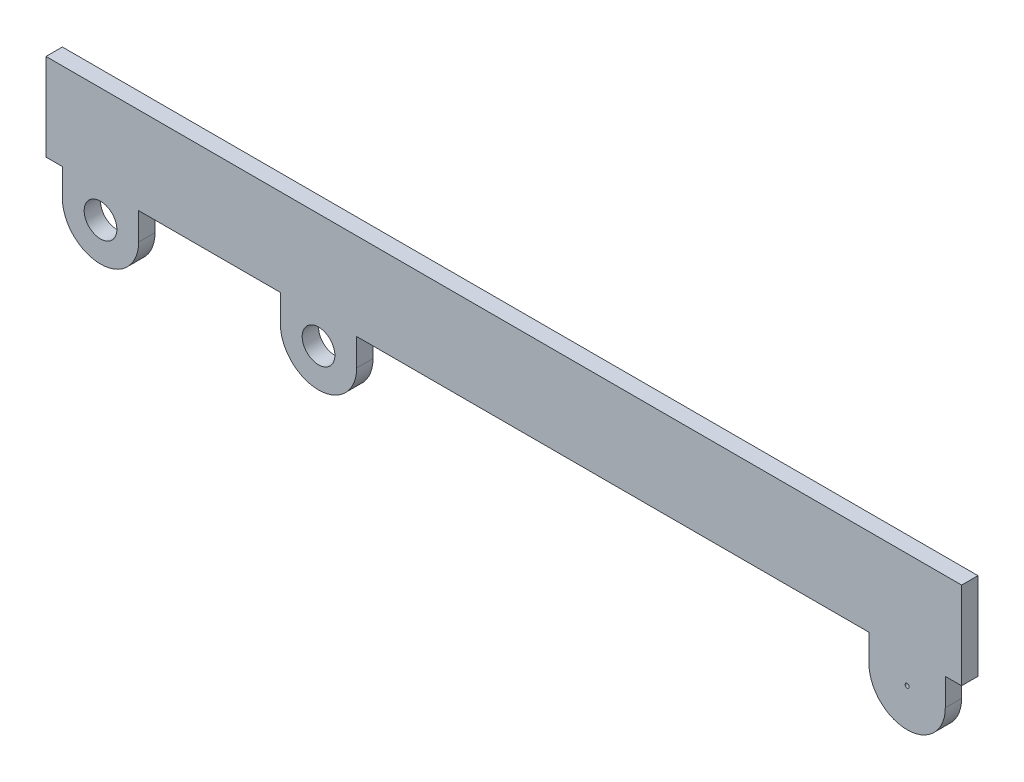
from build123d import *

# Parameters (mm, degrees)
SKETCH1_W           = 1066.8
SKETCH1_H           = 101.6
BOSS_EXTRUDE1_DEPTH = 19.05
SKETCH2_R           = 19.05
SKETCH2_R_2         = 2.38125
BOSS_EXTRUDE2_DEPTH = 19.05
SKETCH4_R           = 19.05
CUT_EXTRUDE1_DEPTH  = 9.525


with BuildPart() as part:
    # Sketch1 → Boss-Extrude1 (new body)
    with BuildSketch(Plane.XY):
        Rectangle(SKETCH1_W, SKETCH1_H)
    extrude(amount=BOSS_EXTRUDE1_DEPTH)

    # Sketch2 → Boss-Extrude2 (add)
    # profile 1 of 3: a face of its own
    with BuildSketch(Plane.XY.offset(19.05)):
        with BuildLine():
            Line((-514.35, -50.8), (-425.45, -50.8))
            Line((-425.45, -50.8), (-425.45, -82.55))
            ThreePointArc((-425.45, -82.55), (-469.9, -127), (-514.35, -82.55))
            Line((-514.35, -82.55), (-514.35, -50.8))
        make_face()
        with Locations((-469.9, -82.55)):
            Circle(SKETCH2_R, mode=Mode.SUBTRACT)
    # profile 2 of 3: a face of its own
    with BuildSketch(Plane.XY.offset(19.05)):
        with BuildLine():
            Line((514.35, -50.8), (425.45, -50.8))
            Line((425.45, -50.8), (425.45, -82.55))
            ThreePointArc((425.45, -82.55), (469.9, -127), (514.35, -82.55))
            Line((514.35, -82.55), (514.35, -50.8))
        make_face()
        with Locations((469.9, -82.55)):
            Circle(SKETCH2_R_2, mode=Mode.SUBTRACT)
    # profile 3 of 3: a face of its own
    with BuildSketch(Plane.XY.offset(19.05)):
        with BuildLine():
            Line((-260.35, -50.8), (-171.45, -50.8))
            Line((-171.45, -50.8), (-171.45, -82.55))
            ThreePointArc((-171.45, -82.55), (-215.9, -127), (-260.35, -82.55))
            Line((-260.35, -82.55), (-260.35, -50.8))
        make_face()
        with Locations((-215.9, -82.55)):
            Circle(SKETCH2_R, mode=Mode.SUBTRACT)
    extrude(amount=-BOSS_EXTRUDE2_DEPTH)

    # Sketch4 → Cut-Extrude1 (cut)
    with BuildSketch(Plane(origin=(0, 0, 0), x_dir=(-1, 0, 0), z_dir=(0, 0, -1))):
        with Locations((-469.9, -82.55)):
            Circle(SKETCH4_R)
    extrude(amount=-CUT_EXTRUDE1_DEPTH, mode=Mode.SUBTRACT)


solid = part.part
